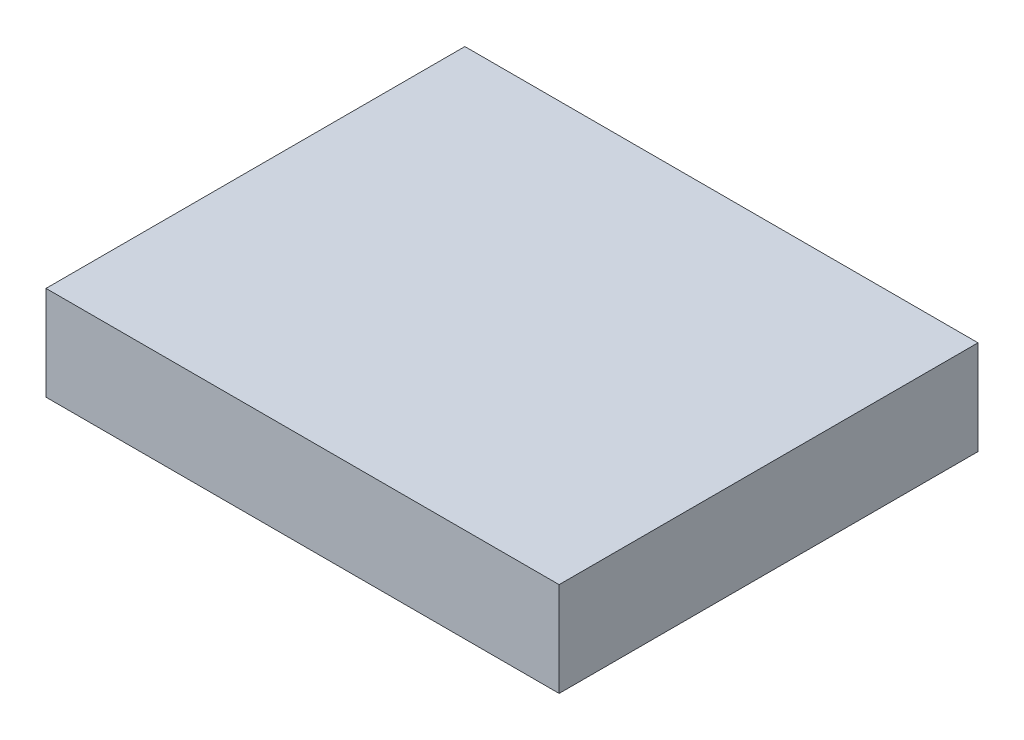
from build123d import *

# Parameters (mm, degrees)
SKETCH1_W           = 73.5
SKETCH1_H           = 13.5
BOSS_EXTRUDE1_DEPTH = 30


with BuildPart() as part:
    # Sketch1 → Boss-Extrude1 (new, symmetric)
    with BuildSketch(Plane.XY):
        Rectangle(SKETCH1_W, SKETCH1_H)
    extrude(amount=BOSS_EXTRUDE1_DEPTH, both=True)


solid = part.part
